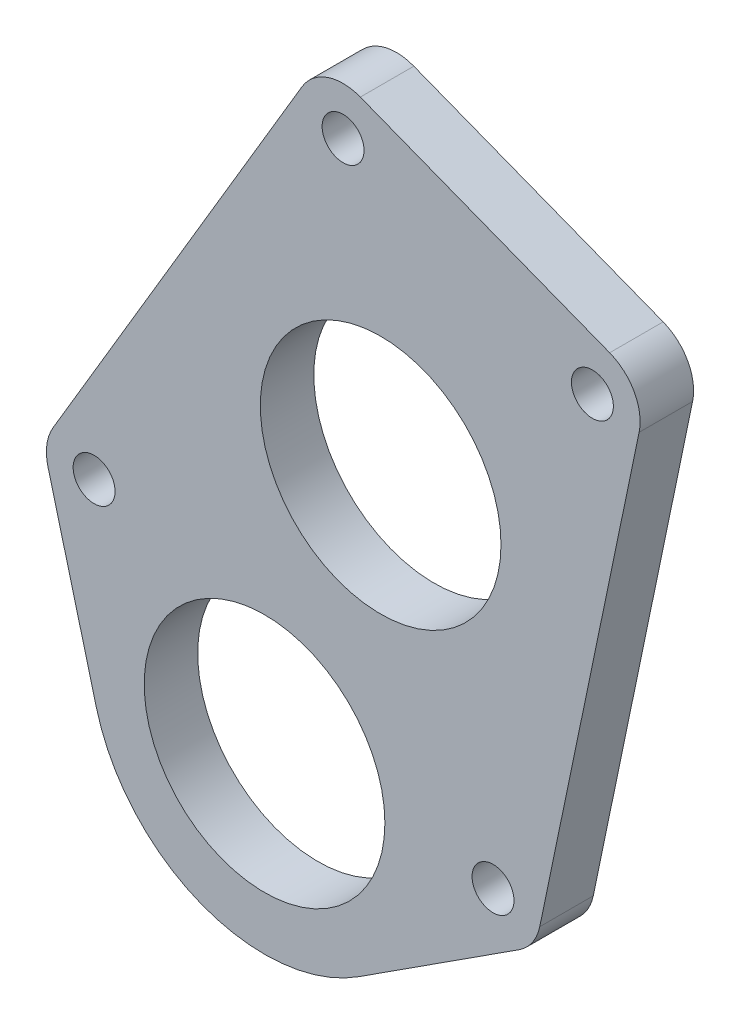
from build123d import *

# Parameters (mm, degrees)
SKETCH1_R           = 14.2875
SKETCH1_R_2         = 2.4892
BOSS_EXTRUDE1_DEPTH = 3.175


with BuildPart() as part:
    # Sketch1 → Boss-Extrude1 (new, symmetric)
    with BuildSketch(Plane.XY):
        with BuildLine():
            Line((-25.711392616, 16.628788534), (-19.959064153, -5.248062916))
            ThreePointArc((-19.959064153, -5.248062916), (-7.46638511, -19.239529611), (11.194044807, -17.337813216))
            Line((11.194044807, -17.337813216), (30.197779716, -5.06817705))
            ThreePointArc((30.197779716, -5.06817705), (31.796268643, -3.513762679), (32.671001067, -1.462857007))
            Line((32.671001067, -1.462857007), (44.467361552, 55.261864273))
            ThreePointArc((44.467361552, 55.261864273), (43.898602792, 59.119668038), (40.971040985, 61.695618015))
            Line((40.971040985, 61.695618015), (11.371764661, 73.182364338))
            ThreePointArc((11.371764661, 73.182364338), (7.472947104, 73.255563185), (4.450757502, 70.791317575))
            Line((4.450757502, 70.791317575), (-25.105168777, 20.958644089))
            ThreePointArc((-25.105168777, 20.958644089), (-25.842883045, 18.854565063), (-25.711392616, 16.628788534))
        make_face()
        Circle(SKETCH1_R, mode=Mode.SUBTRACT)
        with Locations((13.784095588, 35.519131589)):
            Circle(SKETCH1_R, mode=Mode.SUBTRACT)
        with Locations((-20.233397162, 18.069179956)):
            Circle(SKETCH1_R_2, mode=Mode.SUBTRACT)
        with Locations((27.125444956, -0.309614161)):
            Circle(SKETCH1_R_2, mode=Mode.SUBTRACT)
        with Locations((38.921805441, 56.415107119)):
            Circle(SKETCH1_R_2, mode=Mode.SUBTRACT)
        with Locations((9.322529117, 67.901853442)):
            Circle(SKETCH1_R_2, mode=Mode.SUBTRACT)
    extrude(amount=BOSS_EXTRUDE1_DEPTH, both=True)


solid = part.part
